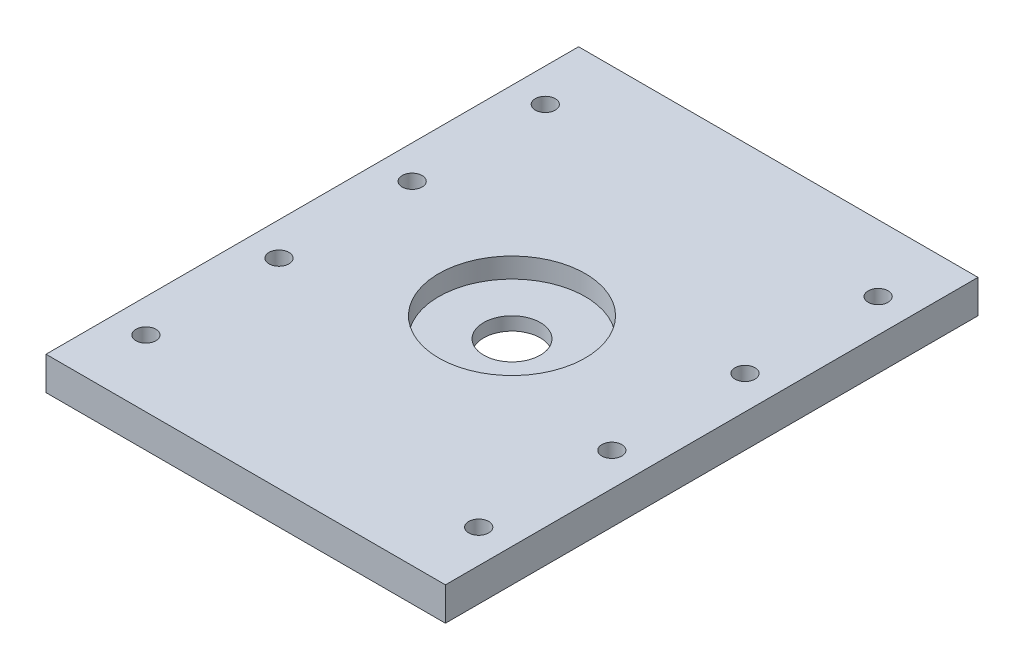
from build123d import *

# Parameters (mm, degrees)
SKETCH1_W           = 60
SKETCH1_H           = 80
SKETCH1_R           = 1.5
SKETCH1_R_2         = 4.25
BOSS_EXTRUDE1_DEPTH = 5
SKETCH2_R           = 11
CUT_EXTRUDE1_DEPTH  = 3


with BuildPart() as part:
    # Sketch1 → Boss-Extrude1 (new body)
    with BuildSketch(Plane(origin=(0, 0, 0), x_dir=(1, 0, 0), z_dir=(0, 1, 0))):
        Rectangle(SKETCH1_W, SKETCH1_H)
        with Locations(Location((-25, 30, 0), (0, 0, 270))):
            Circle(SKETCH1_R, mode=Mode.SUBTRACT)
        with Locations(Location((25, 30, 0), (0, 0, 270))):
            Circle(SKETCH1_R, mode=Mode.SUBTRACT)
        with Locations(Location((25, 10, 0), (0, 0, 270))):
            Circle(SKETCH1_R, mode=Mode.SUBTRACT)
        with Locations(Location((25, -10, 0), (0, 0, 270))):
            Circle(SKETCH1_R, mode=Mode.SUBTRACT)
        with Locations(Location((25, -30, 0), (0, 0, 270))):
            Circle(SKETCH1_R, mode=Mode.SUBTRACT)
        with Locations(Location((-25, 10, 0), (0, 0, 270))):
            Circle(SKETCH1_R, mode=Mode.SUBTRACT)
        with Locations(Location((-25, -10, 0), (0, 0, 270))):
            Circle(SKETCH1_R, mode=Mode.SUBTRACT)
        with Locations(Location((-25, -30, 0), (0, 0, 270))):
            Circle(SKETCH1_R, mode=Mode.SUBTRACT)
        with Locations(Location((0, 0, 0), (0, 0, 270))):
            Circle(SKETCH1_R_2, mode=Mode.SUBTRACT)
    extrude(amount=BOSS_EXTRUDE1_DEPTH)

    # Sketch2 → Cut-Extrude1 (cut)
    with BuildSketch(Plane(origin=(0, 5, 0), x_dir=(1, 0, 0), z_dir=(0, 1, 0))):
        with Locations(Location((0, 0, 0), (0, 0, 270))):
            Circle(SKETCH2_R)
    extrude(amount=-CUT_EXTRUDE1_DEPTH, mode=Mode.SUBTRACT)


solid = part.part
